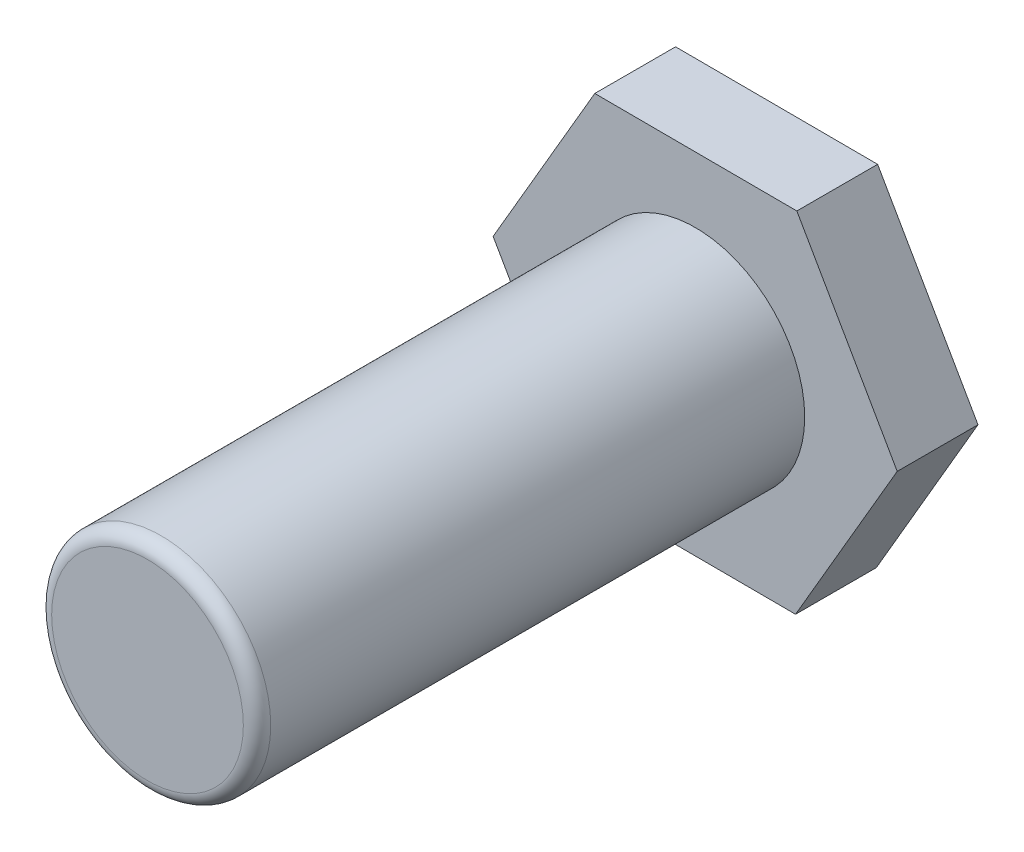
from build123d import *

# Parameters (mm, degrees)
Y_KSEKLIK_EKSTR_ZYON1_DEPTH = 2.95
IZIM3_R                     = 4
Y_KSEKLIK_EKSTR_ZYON2_DEPTH = 20
RADYUS3_R                   = 0.5


with BuildPart() as part:
    # Çizim2 → Yükseklik-Ekstrüzyon1 (new body)
    with BuildSketch(Plane.XY):
        Polygon((3.712848138, 6.376327996), (-3.665637958, 6.403584805), (-7.378486096, 0.02725681), (-3.712848138, -6.376327996), (3.665637958, -6.403584805), (7.378486096, -0.02725681), align=None)
    extrude(amount=Y_KSEKLIK_EKSTR_ZYON1_DEPTH)

    # Çizim3 → Yükseklik-Ekstrüzyon2 (add)
    with BuildSketch(Plane.XY.offset(2.95)):
        Circle(IZIM3_R)
    extrude(amount=Y_KSEKLIK_EKSTR_ZYON2_DEPTH)

    # Radyus3
    radyus3_edges = [part.edges().sort_by_distance(p)[0] for p in [
        (-4, 0, 22.95),
    ]]
    fillet(radyus3_edges, radius=RADYUS3_R)


solid = part.part
